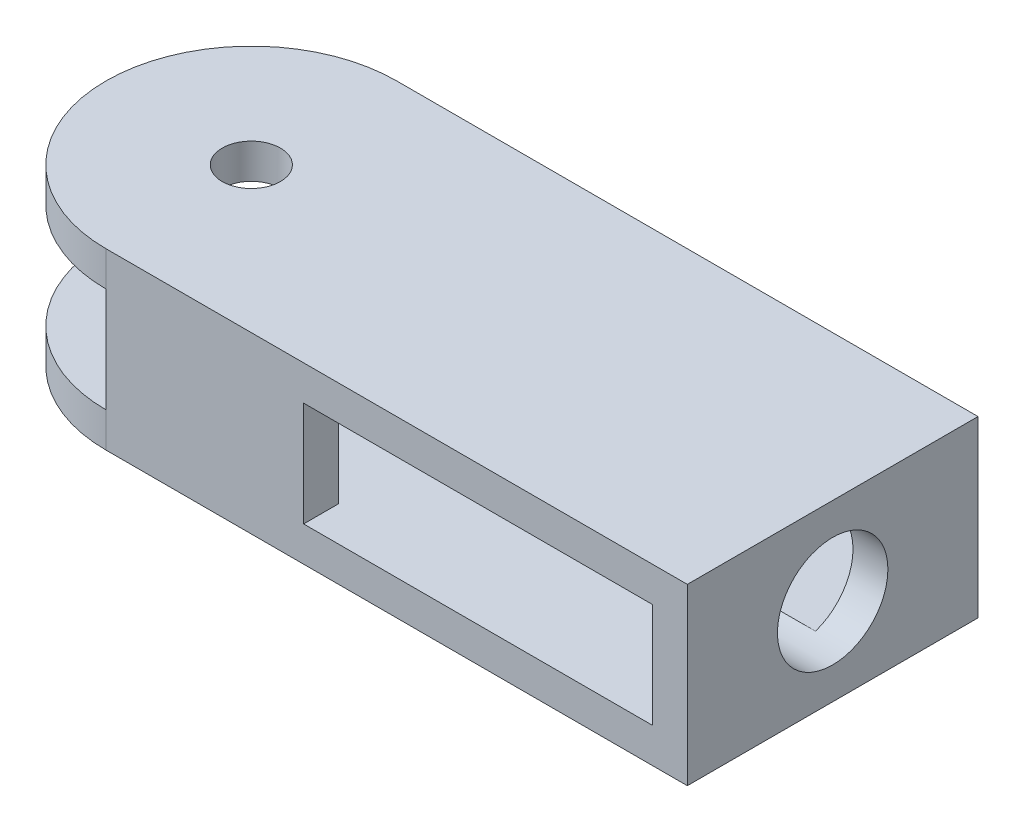
from build123d import *

# Parameters (mm, degrees)
SKETCH1_R               = 5
BOSS_EXTRUDE1_DEPTH     = 15
SKETCH5_R               = 9.5
CUT_EXTRUDE1_DEPTH      = 50
CUT_EXTRUDE2_DEPTH      = 81.467384697
CUT_EXTRUDE2_DEPTH_BACK = 81.467384697
SKETCH6_W               = 60
SKETCH6_H               = 18
SKETCH6_W_2             = 25
SKETCH7_W               = 38
SKETCH7_H               = 18
CUT_EXTRUDE3_DEPTH      = 73.15261603


with BuildPart() as part:
    # Sketch1 → Boss-Extrude1 (new, symmetric)
    with BuildSketch(Plane(origin=(0, 0, 0), x_dir=(1, 0, 0), z_dir=(0, 1, 0))):
        with BuildLine():
            Line((-50, 25), (50, 25))
            Line((50, 25), (50, -25))
            Line((50, -25), (-50, -25))
            ThreePointArc((-50, -25), (-75, 0), (-50, 25))
        make_face()
        with Locations(Location((-50, 0, 0), (0, 0, 270))):
            Circle(SKETCH1_R, mode=Mode.SUBTRACT)
    extrude(amount=BOSS_EXTRUDE1_DEPTH, both=True)

    # Sketch5 → Cut-Extrude1 (cut)
    with BuildSketch(Plane(origin=(50, 0, 0), x_dir=(0, 0, -1), z_dir=(1, 0, 0))):
        Circle(SKETCH5_R)
    extrude(amount=-CUT_EXTRUDE1_DEPTH, mode=Mode.SUBTRACT)

    # Sketch6 → Cut-Extrude2 (cut, two sides: drawn at the far end of the back side and taken through both)
    with BuildSketch(Plane.XY.offset(-CUT_EXTRUDE2_DEPTH_BACK)):
        with Locations((14, 0)):
            Rectangle(SKETCH6_W, SKETCH6_H)
        with Locations((-62.5, 0)):
            Rectangle(SKETCH6_W_2, SKETCH6_H)
    extrude(amount=CUT_EXTRUDE2_DEPTH + CUT_EXTRUDE2_DEPTH_BACK, mode=Mode.SUBTRACT)

    # Sketch7 → Cut-Extrude3 (cut, through all)
    with BuildSketch(Plane(origin=(-16, 0, 0), x_dir=(0, 0, -1), z_dir=(1, 0, 0))):
        Rectangle(SKETCH7_W, SKETCH7_H)
    extrude(amount=-CUT_EXTRUDE3_DEPTH, mode=Mode.SUBTRACT)


solid = part.part
